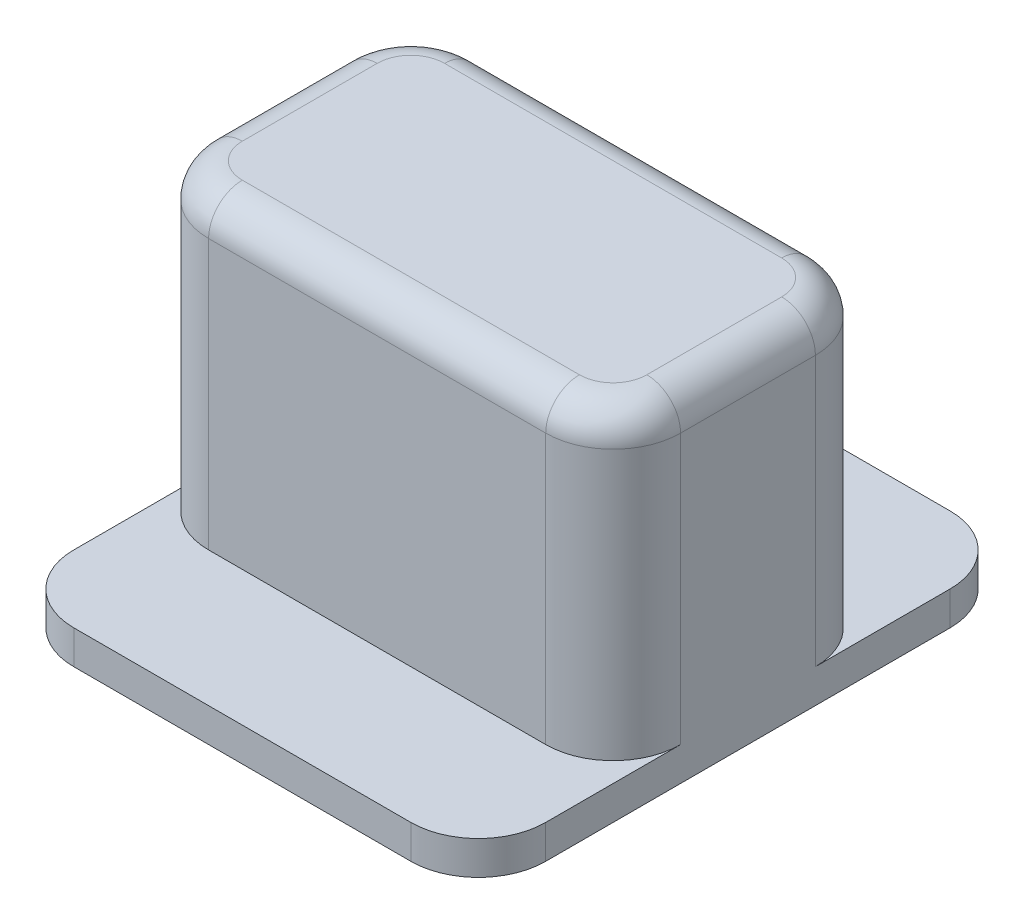
from build123d import *

# Parameters (mm, degrees)
SKETCH_1_W          = 7
SKETCH_1_H          = 8
EXTRUDE_1_DEPTH     = 1
EXTRUDE_2_DEPTH     = 4.5
FILLET_1_R          = 1
FILLET_2_R          = 0.5
CUT_EXTRUDE_START   = -0.5
CUT_EXTRUDE_1_DEPTH = 0.5


with BuildPart() as part:
    # 草图1 → 凸台-拉伸1 (new body)
    with BuildSketch(Plane(origin=(0, 0, 0), x_dir=(1, 0, 0), z_dir=(0, 1, 0))):
        with Locations((30.052937772, 4.5)):
            Rectangle(SKETCH_1_W, SKETCH_1_H)
    extrude(amount=EXTRUDE_1_DEPTH)

    # 草图2 → 凸台-拉伸2 (add)
    with BuildSketch(Plane(origin=(0, 1, 0), x_dir=(1, 0, 0), z_dir=(0, 1, 0))):
        Polygon((26.552937772, 4.5), (26.552937772, 6.5), (33.552937772, 6.5), (33.552937772, 2.5), (26.552937772, 2.5), align=None)
    extrude(amount=EXTRUDE_2_DEPTH)

    # 圆角1
    fillet_1_edges = [part.edges().sort_by_distance(p)[0] for p in [
        (26.552937772, 3.25, -2.5),
        (33.552937772, 3.25, -2.5),
        (33.552937772, 3.25, -6.5),
        (26.552937772, 3.25, -6.5),
        (26.552937772, 0.5, -8.5),
        (33.552937772, 0.5, -8.5),
        (33.552937772, 0.5, -0.5),
        (26.552937772, 0.5, -0.5),
    ]]
    fillet(fillet_1_edges, radius=FILLET_1_R)

    # 圆角2
    fillet_2_edges = [part.edges().sort_by_distance(p)[0] for p in [
        (26.552937772, 5.5, -4.5),
        (30.052937772, 5.5, -6.5),
        (30.052937772, 5.5, -2.5),
        (33.552937772, 5.5, -4.5),
        (33.260044553, 5.5, -6.207106781),
        (33.260044553, 5.5, -2.792893219),
        (26.84583099, 5.5, -2.792893219),
        (26.84583099, 5.5, -6.207106781),
    ]]
    fillet(fillet_2_edges, radius=FILLET_2_R)

    # 草图3 → 切除-拉伸1 (cut)
    with BuildSketch(Plane.XZ.offset(CUT_EXTRUDE_START)):
        with BuildLine():
            Line((26.552937772, -1.5), (26.552937772, -7.5))
            ThreePointArc((26.552937772, -7.5), (26.84583099, -8.207106781), (27.552937772, -8.5))
            Line((27.552937772, -8.5), (32.552937772, -8.5))
            ThreePointArc((32.552937772, -8.5), (33.260044553, -8.207106781), (33.552937772, -7.5))
            Line((33.552937772, -7.5), (33.552937772, -1.5))
            ThreePointArc((33.552937772, -1.5), (33.260044553, -0.792893219), (32.552937772, -0.5))
            Line((32.552937772, -0.5), (27.552937772, -0.5))
            ThreePointArc((27.552937772, -0.5), (26.84583099, -0.792893219), (26.552937772, -1.5))
        make_face()
    extrude(amount=CUT_EXTRUDE_1_DEPTH, mode=Mode.SUBTRACT)


solid = part.part
